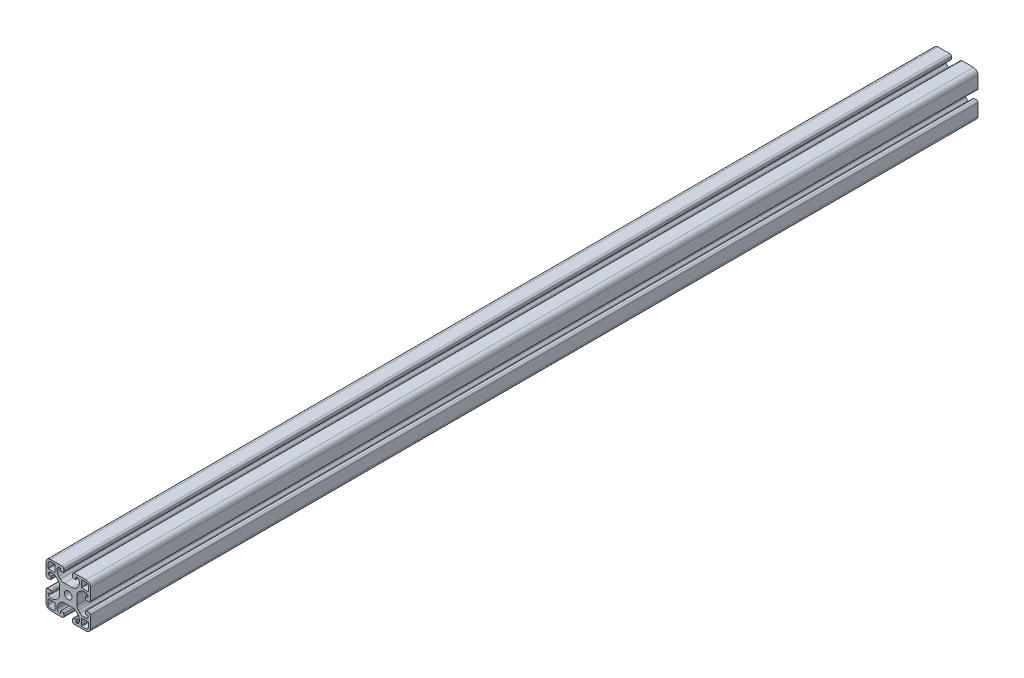
from build123d import *

# Parameters (mm, degrees)
ESQUISSE1_R        = 3.4
BOSS_EXTRU_1_DEPTH = 800


with BuildPart() as part:
    # Esquisse1 → Boss.-Extru.1 (new body)
    with BuildSketch(Plane(origin=(0, 0, -30), x_dir=(-1, 0, 0), z_dir=(0, 0, -1))):
        with BuildLine():
            Line((-4.5, 15), (-4.5, 13.5))
            ThreePointArc((-4.5, 13.5), (-4.353553391, 13.146446609), (-4, 13))
            Line((-4, 13), (-2.5, 13))
            ThreePointArc((-2.5, 13), (-2.146446609, 12.853553391), (-2, 12.5))
            ThreePointArc((-2, 12.5), (-2.732233047, 10.732233047), (-4.5, 10))
            Line((-4.5, 10), (-5.807611845, 10))
            ThreePointArc((-5.807611845, 10), (-7.721029006, 10.380602337), (-9.343145751, 11.464466094))
            Line((-9.343145751, 11.464466094), (-10.785533906, 12.906854249))
            ThreePointArc((-10.785533906, 12.906854249), (-11.869397663, 14.528970994), (-12.25, 16.442388155))
            Line((-12.25, 16.442388155), (-12.25, 23.557611845))
            ThreePointArc((-12.25, 23.557611845), (-11.869397663, 25.471029006), (-10.785533906, 27.093145751))
            Line((-10.785533906, 27.093145751), (-9.343145751, 28.535533906))
            ThreePointArc((-9.343145751, 28.535533906), (-7.721029006, 29.619397663), (-5.807611845, 30))
            Line((-5.807611845, 30), (-4.5, 30))
            ThreePointArc((-4.5, 30), (-2.732233047, 29.267766953), (-2, 27.5))
            ThreePointArc((-2, 27.5), (-2.146446609, 27.146446609), (-2.5, 27))
            Line((-2.5, 27), (-4, 27))
            ThreePointArc((-4, 27), (-4.353553391, 26.853553391), (-4.5, 26.5))
            Line((-4.5, 26.5), (-4.5, 25))
            ThreePointArc((-4.5, 25), (-4.207106781, 24.292893219), (-3.5, 24))
            Line((-3.5, 24), (-1.5, 24))
            ThreePointArc((-1.5, 24), (-0.439339828, 24.439339828), (0, 25.5))
            Line((0, 25.5), (0, 36))
            ThreePointArc((0, 36), (-1.171572875, 38.828427125), (-4, 40))
            Line((-4, 40), (-14.5, 40))
            ThreePointArc((-14.5, 40), (-15.560660172, 39.560660172), (-16, 38.5))
            Line((-16, 38.5), (-16, 36.5))
            ThreePointArc((-16, 36.5), (-15.707106781, 35.792893219), (-15, 35.5))
            Line((-15, 35.5), (-13.5, 35.5))
            ThreePointArc((-13.5, 35.5), (-13.146446609, 35.646446609), (-13, 36))
            Line((-13, 36), (-13, 37.5))
            ThreePointArc((-13, 37.5), (-12.853553391, 37.853553391), (-12.5, 38))
            ThreePointArc((-12.5, 38), (-10.732233047, 37.267766953), (-10, 35.5))
            Line((-10, 35.5), (-10, 34.192388155))
            ThreePointArc((-10, 34.192388155), (-10.380602337, 32.278970994), (-11.464466094, 30.656854249))
            Line((-11.464466094, 30.656854249), (-12.906854249, 29.214466094))
            ThreePointArc((-12.906854249, 29.214466094), (-14.528970994, 28.130602337), (-16.442388155, 27.75))
            Line((-16.442388155, 27.75), (-23.557611845, 27.75))
            ThreePointArc((-23.557611845, 27.75), (-25.471029006, 28.130602337), (-27.093145751, 29.214466094))
            Line((-27.093145751, 29.214466094), (-28.535533906, 30.656854249))
            ThreePointArc((-28.535533906, 30.656854249), (-29.619397663, 32.278970994), (-30, 34.192388155))
            Line((-30, 34.192388155), (-30, 35.5))
            ThreePointArc((-30, 35.5), (-29.267766953, 37.267766953), (-27.5, 38))
            ThreePointArc((-27.5, 38), (-27.146446609, 37.853553391), (-27, 37.5))
            Line((-27, 37.5), (-27, 36))
            ThreePointArc((-27, 36), (-26.853553391, 35.646446609), (-26.5, 35.5))
            Line((-26.5, 35.5), (-25, 35.5))
            ThreePointArc((-25, 35.5), (-24.292893219, 35.792893219), (-24, 36.5))
            Line((-24, 36.5), (-24, 38.5))
            ThreePointArc((-24, 38.5), (-24.439339828, 39.560660172), (-25.5, 40))
            Line((-25.5, 40), (-36, 40))
            ThreePointArc((-36, 40), (-38.828427125, 38.828427125), (-40, 36))
            Line((-40, 36), (-40, 25.5))
            ThreePointArc((-40, 25.5), (-39.560660172, 24.439339828), (-38.5, 24))
            Line((-38.5, 24), (-36.5, 24))
            ThreePointArc((-36.5, 24), (-35.792893219, 24.292893219), (-35.5, 25))
            Line((-35.5, 25), (-35.5, 26.5))
            ThreePointArc((-35.5, 26.5), (-35.646446609, 26.853553391), (-36, 27))
            Line((-36, 27), (-37.5, 27))
            ThreePointArc((-37.5, 27), (-37.853553391, 27.146446609), (-38, 27.5))
            ThreePointArc((-38, 27.5), (-37.267766953, 29.267766953), (-35.5, 30))
            Line((-35.5, 30), (-34.192388155, 30))
            ThreePointArc((-34.192388155, 30), (-32.278970994, 29.619397663), (-30.656854249, 28.535533906))
            Line((-30.656854249, 28.535533906), (-29.214466094, 27.093145751))
            ThreePointArc((-29.214466094, 27.093145751), (-28.130602337, 25.471029006), (-27.75, 23.557611845))
            Line((-27.75, 23.557611845), (-27.75, 16.442388155))
            ThreePointArc((-27.75, 16.442388155), (-28.130602337, 14.528970994), (-29.214466094, 12.906854249))
            Line((-29.214466094, 12.906854249), (-30.656854249, 11.464466094))
            ThreePointArc((-30.656854249, 11.464466094), (-32.278970994, 10.380602337), (-34.192388155, 10))
            Line((-34.192388155, 10), (-35.5, 10))
            ThreePointArc((-35.5, 10), (-37.267766953, 10.732233047), (-38, 12.5))
            ThreePointArc((-38, 12.5), (-37.853553391, 12.853553391), (-37.5, 13))
            Line((-37.5, 13), (-36, 13))
            ThreePointArc((-36, 13), (-35.646446609, 13.146446609), (-35.5, 13.5))
            Line((-35.5, 13.5), (-35.5, 15))
            ThreePointArc((-35.5, 15), (-35.792893219, 15.707106781), (-36.5, 16))
            Line((-36.5, 16), (-38.5, 16))
            ThreePointArc((-38.5, 16), (-39.560660172, 15.560660172), (-40, 14.5))
            Line((-40, 14.5), (-40, 4))
            ThreePointArc((-40, 4), (-38.828427125, 1.171572875), (-36, 0))
            Line((-36, 0), (-25.5, 0))
            ThreePointArc((-25.5, 0), (-24.439339828, 0.439339828), (-24, 1.5))
            Line((-24, 1.5), (-24, 3.5))
            ThreePointArc((-24, 3.5), (-24.292893219, 4.207106781), (-25, 4.5))
            Line((-25, 4.5), (-26.5, 4.5))
            ThreePointArc((-26.5, 4.5), (-26.853553391, 4.353553391), (-27, 4))
            Line((-27, 4), (-27, 2.5))
            ThreePointArc((-27, 2.5), (-27.146446609, 2.146446609), (-27.5, 2))
            ThreePointArc((-27.5, 2), (-29.267766953, 2.732233047), (-30, 4.5))
            Line((-30, 4.5), (-30, 5.807611845))
            ThreePointArc((-30, 5.807611845), (-29.619397663, 7.721029006), (-28.535533906, 9.343145751))
            Line((-28.535533906, 9.343145751), (-27.093145751, 10.785533906))
            ThreePointArc((-27.093145751, 10.785533906), (-25.471029006, 11.869397663), (-23.557611845, 12.25))
            Line((-23.557611845, 12.25), (-16.442388155, 12.25))
            ThreePointArc((-16.442388155, 12.25), (-14.528970994, 11.869397663), (-12.906854249, 10.785533906))
            Line((-12.906854249, 10.785533906), (-11.464466094, 9.343145751))
            ThreePointArc((-11.464466094, 9.343145751), (-10.380602337, 7.721029006), (-10, 5.807611845))
            Line((-10, 5.807611845), (-10, 4.5))
            ThreePointArc((-10, 4.5), (-10.732233047, 2.732233047), (-12.5, 2))
            ThreePointArc((-12.5, 2), (-12.853553391, 2.146446609), (-13, 2.5))
            Line((-13, 2.5), (-13, 4))
            ThreePointArc((-13, 4), (-13.146446609, 4.353553391), (-13.5, 4.5))
            Line((-13.5, 4.5), (-15, 4.5))
            ThreePointArc((-15, 4.5), (-15.707106781, 4.207106781), (-16, 3.5))
            Line((-16, 3.5), (-16, 1.5))
            ThreePointArc((-16, 1.5), (-15.560660172, 0.439339828), (-14.5, 0))
            Line((-14.5, 0), (-4, 0))
            ThreePointArc((-4, 0), (-1.171572875, 1.171572875), (0, 4))
            Line((0, 4), (0, 14.5))
            ThreePointArc((0, 14.5), (-0.439339828, 15.560660172), (-1.5, 16))
            Line((-1.5, 16), (-3.5, 16))
            ThreePointArc((-3.5, 16), (-4.207106781, 15.707106781), (-4.5, 15))
        make_face()
        with Locations(Location((-20, 20, 0), (0, 0, 180))):
            Circle(ESQUISSE1_R, mode=Mode.SUBTRACT)
        with BuildLine():
            Line((-4, 1.8), (-7.7, 1.8))
            ThreePointArc((-7.7, 1.8), (-8.053553391, 1.946446609), (-8.2, 2.3))
            Line((-8.2, 2.3), (-8.2, 7.7))
            ThreePointArc((-8.2, 7.7), (-8.053553391, 8.053553391), (-7.7, 8.2))
            Line((-7.7, 8.2), (-2.3, 8.2))
            ThreePointArc((-2.3, 8.2), (-1.946446609, 8.053553391), (-1.8, 7.7))
            Line((-1.8, 7.7), (-1.8, 4))
            ThreePointArc((-1.8, 4), (-2.444365081, 2.444365081), (-4, 1.8))
        make_face(mode=Mode.SUBTRACT)
        with BuildLine():
            Line((-38.2, 4), (-38.2, 7.7))
            ThreePointArc((-38.2, 7.7), (-38.053553391, 8.053553391), (-37.7, 8.2))
            Line((-37.7, 8.2), (-32.3, 8.2))
            ThreePointArc((-32.3, 8.2), (-31.946446609, 8.053553391), (-31.8, 7.7))
            Line((-31.8, 7.7), (-31.8, 2.3))
            ThreePointArc((-31.8, 2.3), (-31.946446609, 1.946446609), (-32.3, 1.8))
            Line((-32.3, 1.8), (-36, 1.8))
            ThreePointArc((-36, 1.8), (-37.555634919, 2.444365081), (-38.2, 4))
        make_face(mode=Mode.SUBTRACT)
        with BuildLine():
            Line((-36, 38.2), (-32.3, 38.2))
            ThreePointArc((-32.3, 38.2), (-31.946446609, 38.053553391), (-31.8, 37.7))
            Line((-31.8, 37.7), (-31.8, 32.3))
            ThreePointArc((-31.8, 32.3), (-31.946446609, 31.946446609), (-32.3, 31.8))
            Line((-32.3, 31.8), (-37.7, 31.8))
            ThreePointArc((-37.7, 31.8), (-38.053553391, 31.946446609), (-38.2, 32.3))
            Line((-38.2, 32.3), (-38.2, 36))
            ThreePointArc((-38.2, 36), (-37.555634919, 37.555634919), (-36, 38.2))
        make_face(mode=Mode.SUBTRACT)
        with BuildLine():
            Line((-1.8, 36), (-1.8, 32.3))
            ThreePointArc((-1.8, 32.3), (-1.946446609, 31.946446609), (-2.3, 31.8))
            Line((-2.3, 31.8), (-7.7, 31.8))
            ThreePointArc((-7.7, 31.8), (-8.053553391, 31.946446609), (-8.2, 32.3))
            Line((-8.2, 32.3), (-8.2, 37.7))
            ThreePointArc((-8.2, 37.7), (-8.053553391, 38.053553391), (-7.7, 38.2))
            Line((-7.7, 38.2), (-4, 38.2))
            ThreePointArc((-4, 38.2), (-2.444365081, 37.555634919), (-1.8, 36))
        make_face(mode=Mode.SUBTRACT)
    extrude(amount=-BOSS_EXTRU_1_DEPTH)


solid = part.part
